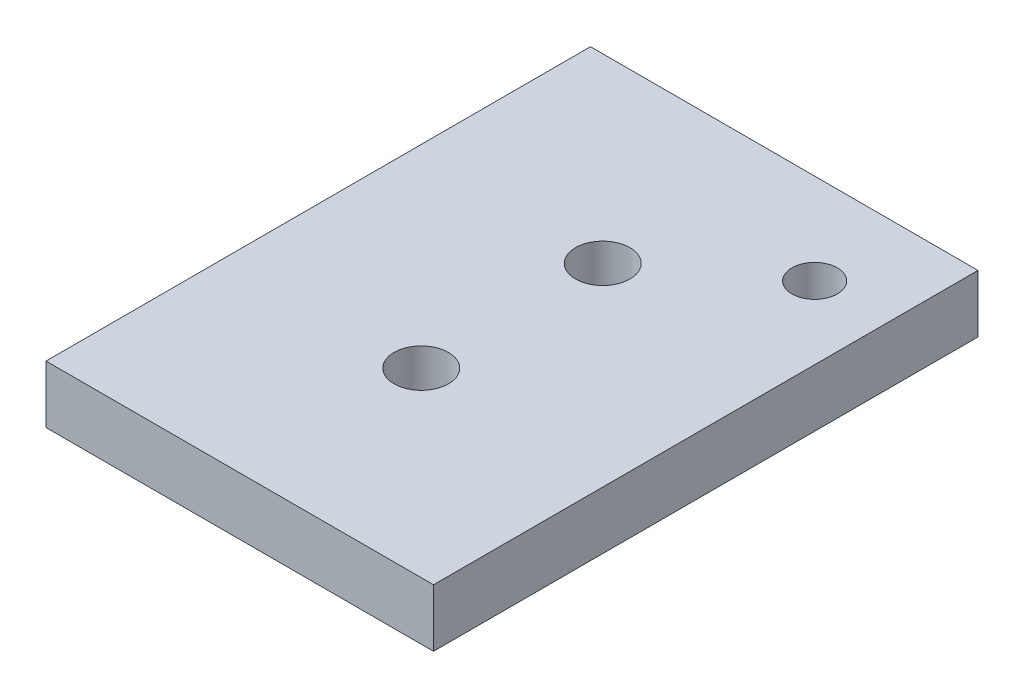
from build123d import *

# Parameters (mm, degrees)
SKETCH1_R           = 1.25
BOSS_EXTRUDE1_DEPTH = 3.175


with BuildPart() as part:
    # Sketch1 → Boss-Extrude1 (new body)
    with BuildSketch(Plane(origin=(0, 0, 0), x_dir=(1, 0, 0), z_dir=(0, 1, 0))):
        Polygon((0, 0), (10.675, 0), (21.35, 0), (21.35, 20), (21.35, 30), (0, 30), align=None)
        with BuildLine():
            ThreePointArc((12.175, 10), (11.735660172, 8.939339828), (10.675, 8.5))
            ThreePointArc((10.675, 8.5), (9.175, 10), (10.675, 11.5))
            ThreePointArc((10.675, 11.5), (11.735660172, 11.060660172), (12.175, 10))
        make_face(mode=Mode.SUBTRACT)
        with BuildLine():
            ThreePointArc((12.175, 20), (11.735660172, 18.939339828), (10.675, 18.5))
            ThreePointArc((10.675, 18.5), (9.614339828, 21.060660172), (12.175, 20))
        make_face(mode=Mode.SUBTRACT)
        with Locations((17.35, 25)):
            Circle(SKETCH1_R, mode=Mode.SUBTRACT)
    extrude(amount=BOSS_EXTRUDE1_DEPTH)


solid = part.part
